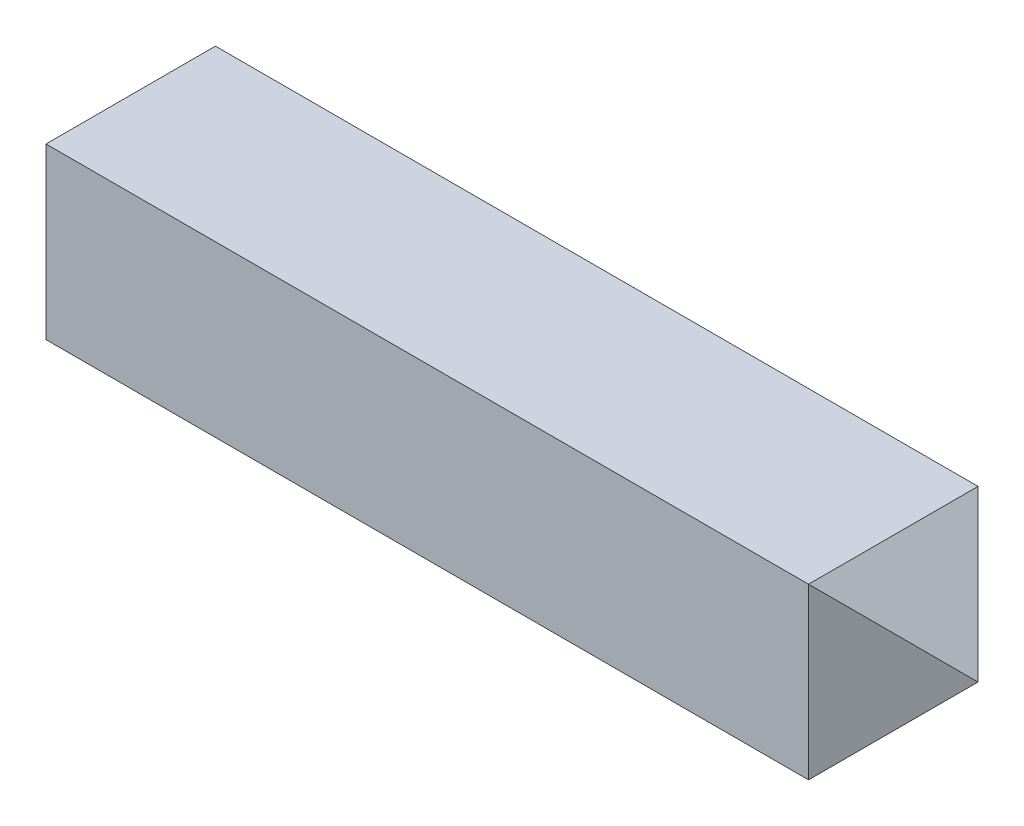
from build123d import *

# Parameters (mm, degrees)
SKETCH_1_W          = 20
SKETCH_1_H          = 20
EXTRUDE_1_DEPTH     = 100
CUT_EXTRUDE_1_DEPTH = 34
CUT_EXTRUDE_2_DEPTH = 34
CUT_EXTRUDE_3_DEPTH = 34


with BuildPart() as part:
    # 草图1 → 凸台-拉伸1 (new body)
    with BuildSketch(Plane(origin=(0, 0, 0), x_dir=(0, 0, -1), z_dir=(1, 0, 0))):
        Rectangle(SKETCH_1_W, SKETCH_1_H)
    extrude(amount=EXTRUDE_1_DEPTH)

    # 草图2 → 切除-拉伸1 (cut)
    with BuildSketch(Plane.XY.offset(10)):
        Polygon((100, 10), (90, 10), (100, 0), align=None)
    extrude(amount=-CUT_EXTRUDE_1_DEPTH, mode=Mode.SUBTRACT)

    # 草图3 → 切除-拉伸2 (cut)
    with BuildSketch(Plane.XY.offset(10)):
        Polygon((100, 0), (100, -10), (90, -10), align=None)
    extrude(amount=-CUT_EXTRUDE_2_DEPTH, mode=Mode.SUBTRACT)

    # 草图4 → 切除-拉伸3 (cut)
    with BuildSketch(Plane(origin=(0, 10, 0), x_dir=(1, 0, 0), z_dir=(0, 1, 0))):
        Polygon((100, 10), (90, 10), (100, 0), align=None)
        Polygon((90, -10), (100, -10), (100, 0), align=None)
    extrude(amount=-CUT_EXTRUDE_3_DEPTH, mode=Mode.SUBTRACT)


solid = part.part
